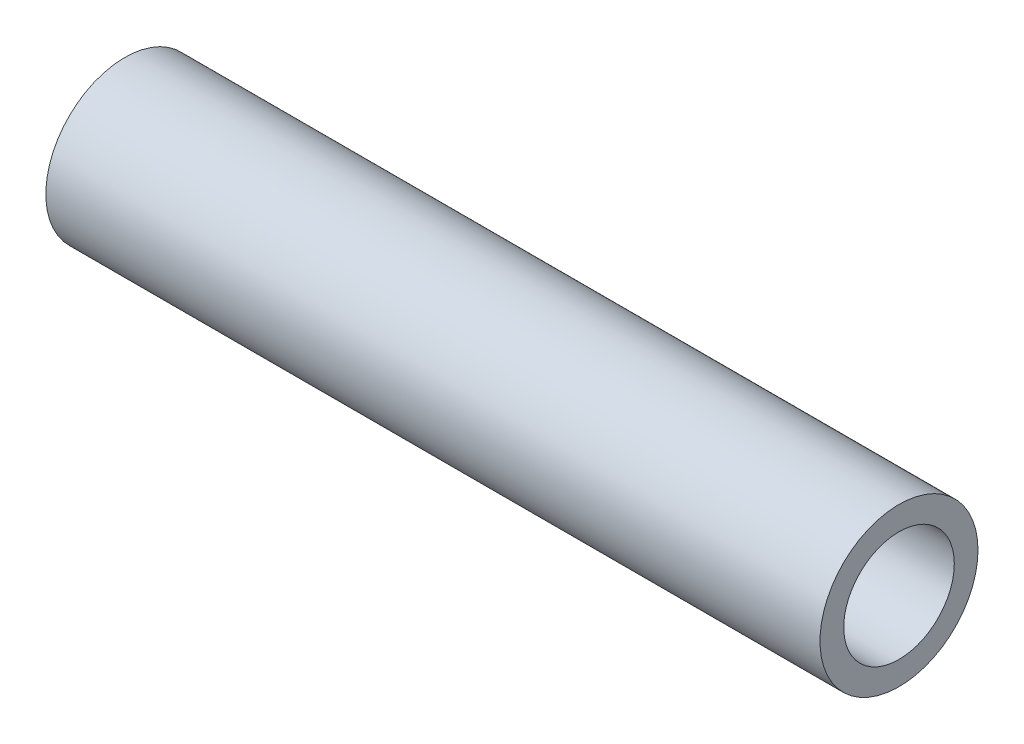
from build123d import *

# Parameters (mm, degrees)
SKETCH1_R           = 5
SKETCH1_R_2         = 3.5
BOSS_EXTRUDE1_DEPTH = 24.5


with BuildPart() as part:
    # Sketch1 → Boss-Extrude1 (new, symmetric)
    with BuildSketch(Plane(origin=(0, 0, 0), x_dir=(0, 0, -1), z_dir=(1, 0, 0))):
        Circle(SKETCH1_R)
        Circle(SKETCH1_R_2, mode=Mode.SUBTRACT)
    extrude(amount=BOSS_EXTRUDE1_DEPTH, both=True)


solid = part.part
